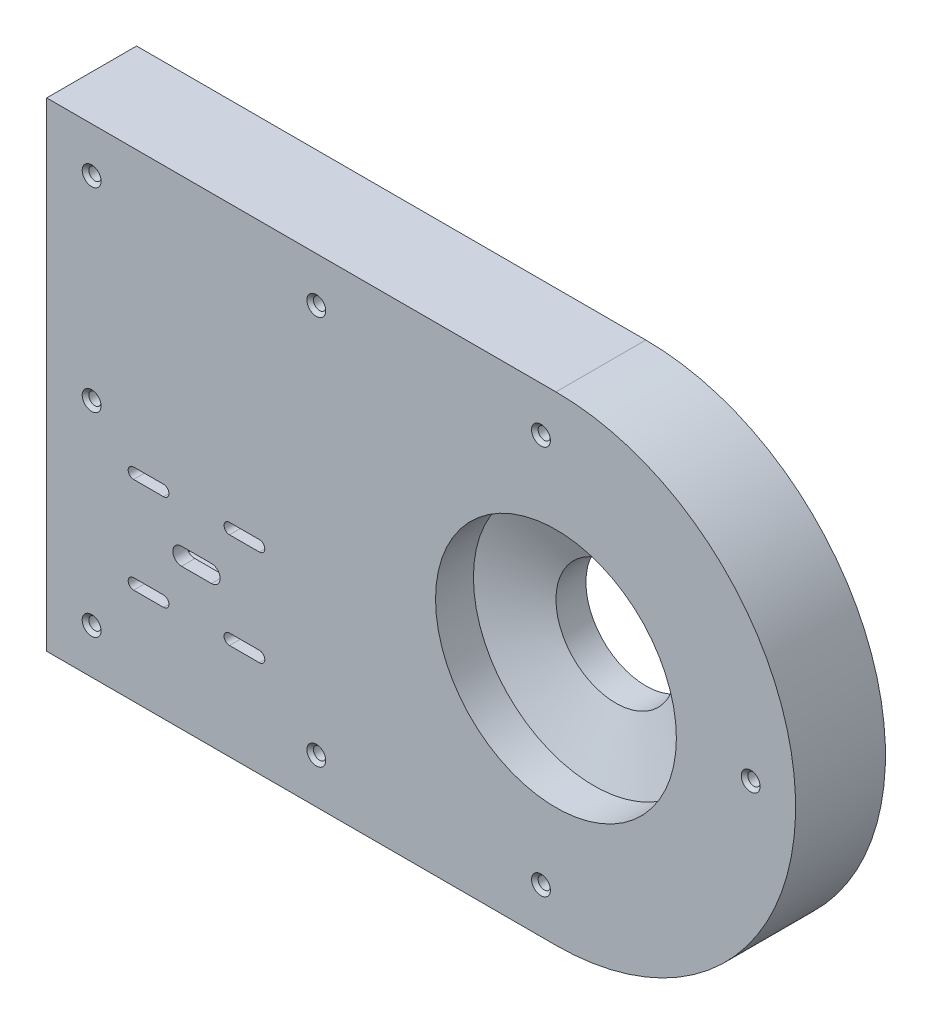
from build123d import *

# Parameters (mm, degrees)
SKETCH1_R                                       = 2.05
BOSS_EXTRUDE1_DEPTH                             = 15
CSK_FOR_M3_FLAT_HEAD_MACHINE_SCREW1_D           = 3.6
CSK_FOR_M3_FLAT_HEAD_MACHINE_SCREW1_CSINK_D     = 6.3
CSK_FOR_M3_FLAT_HEAD_MACHINE_SCREW1_CSINK_ANGLE = 90
CUT_EXTRUDE1_START                              = -10
SKETCH5_R                                       = 40.2
CUT_EXTRUDE1_DEPTH                              = 20
SKETCH6_R                                       = 20
CUT_EXTRUDE2_DEPTH                              = 191.26297592
CUT_EXTRUDE3_DEPTH                              = 22.27
M3_CLEARANCE_HOLE1_D                            = 3.6
M5_CLEARANCE_HOLE1_D                            = 5.8
CUT_EXTRUDE4_DEPTH                              = 3.27
CUT_EXTRUDE5_DEPTH                              = 190.1981842
SKETCH15_R                                      = 45.15
SKETCH15_R_2                                    = 32.35
CUT_EXTRUDE6_DEPTH                              = 2


with BuildPart() as part:
    # Sketch1 → Boss-Extrude1 (new, symmetric)
    with BuildSketch(Plane.XY):
        with BuildLine():
            Line((0, 80), (-170, 80))
            Line((-170, 80), (-170, -80))
            Line((-170, -80), (0, -80))
            ThreePointArc((0, -80), (80, 0), (0, 80))
        make_face()
        with Locations((-155, 65)):
            Circle(SKETCH1_R, mode=Mode.SUBTRACT)
        with Locations((-80, 65)):
            Circle(SKETCH1_R, mode=Mode.SUBTRACT)
        with Locations((-5, 65)):
            Circle(SKETCH1_R, mode=Mode.SUBTRACT)
        with Locations(Location((-155, -65, 0), (0, 0, 180))):
            Circle(SKETCH1_R, mode=Mode.SUBTRACT)
        with Locations(Location((-80, -65, 0), (0, 0, 180))):
            Circle(SKETCH1_R, mode=Mode.SUBTRACT)
        with Locations(Location((-5, -65, 0), (0, 0, 180))):
            Circle(SKETCH1_R, mode=Mode.SUBTRACT)
        with Locations(Location((-155, 0, 0), (0, 0, 180))):
            Circle(SKETCH1_R, mode=Mode.SUBTRACT)
        with Locations((65, 0)):
            Circle(SKETCH1_R, mode=Mode.SUBTRACT)
    extrude(amount=BOSS_EXTRUDE1_DEPTH, both=True)

    # CSK for M3 Flat Head Machine Screw1 (through all)
    with Locations(Plane.XY.offset(15)):
        with Locations((-5, -65), (-80, -65), (-155, -65), (-155, 0), (-155, 65), (-80, 65), (-5, 65), (65, 0)):
            CounterSinkHole(CSK_FOR_M3_FLAT_HEAD_MACHINE_SCREW1_D / 2, CSK_FOR_M3_FLAT_HEAD_MACHINE_SCREW1_CSINK_D / 2, counter_sink_angle=CSK_FOR_M3_FLAT_HEAD_MACHINE_SCREW1_CSINK_ANGLE)

    # Sketch5 → Cut-Extrude1 (cut)
    with BuildSketch(Plane(origin=(0, 0, -15), x_dir=(-1, 0, 0), z_dir=(0, 0, -1)).offset(CUT_EXTRUDE1_START)):
        Circle(SKETCH5_R)
    extrude(amount=-CUT_EXTRUDE1_DEPTH, mode=Mode.SUBTRACT)

    # Sketch6 → Cut-Extrude2 (cut, through all)
    with BuildSketch(Plane(origin=(0, 0, -15), x_dir=(-1, 0, 0), z_dir=(0, 0, -1))):
        Circle(SKETCH6_R)
    extrude(amount=-CUT_EXTRUDE2_DEPTH, mode=Mode.SUBTRACT)

    # Sketch7 → Cut-Extrude3 (cut)
    with BuildSketch(Plane(origin=(0, 0, -15), x_dir=(-1, 0, 0), z_dir=(0, 0, -1))):
        Polygon((103.85, -51.15), (146.15, -51.15), (146.15, -8.85), (103.85, -8.85), (93.85, -8.85), (93.85, -51.15), align=None)
    extrude(amount=-CUT_EXTRUDE3_DEPTH, mode=Mode.SUBTRACT)

    # M3 Clearance Hole1 (through all)
    with Locations(Plane(origin=(0, 0, 7.27), x_dir=(-1, 0, 0), z_dir=(0, 0, -1))):
        with Locations((109, -14), (141, -14), (141, -46), (109, -46), (99, -14), (99, -46), (131, -46), (131, -14)):
            Hole(M3_CLEARANCE_HOLE1_D / 2)

    # M5 Clearance Hole1 (through all)
    with Locations(Plane(origin=(0, 0, 7.27), x_dir=(-1, 0, 0), z_dir=(0, 0, -1))):
        with Locations((125, -30), (115, -30)):
            Hole(M5_CLEARANCE_HOLE1_D / 2)

    # Sketch13 → Cut-Extrude4 (cut)
    with BuildSketch(Plane(origin=(0, 0, 7.27), x_dir=(-1, 0, 0), z_dir=(0, 0, -1))):
        with BuildLine():
            Line((115, -18.85), (125, -18.85))
            ThreePointArc((125, -18.85), (136.15, -30), (125, -41.15))
            Line((125, -41.15), (115, -41.15))
            ThreePointArc((115, -41.15), (103.85, -30), (115, -18.85))
        make_face()
    extrude(amount=-CUT_EXTRUDE4_DEPTH, mode=Mode.SUBTRACT)

    # Sketch14 → Cut-Extrude5 (cut, through all)
    with BuildSketch(Plane(origin=(0, 0, 7.27), x_dir=(-1, 0, 0), z_dir=(0, 0, -1))):
        with BuildLine():
            Line((115, -27.1), (125, -27.1))
            ThreePointArc((125, -27.1), (127.9, -30), (125, -32.9))
            Line((125, -32.9), (115, -32.9))
            ThreePointArc((115, -32.9), (112.1, -30), (115, -27.1))
        make_face()
        with BuildLine():
            Line((99, -12.2), (109, -12.2))
            ThreePointArc((109, -12.2), (110.8, -14), (109, -15.8))
            Line((109, -15.8), (99, -15.8))
            ThreePointArc((99, -15.8), (97.2, -14), (99, -12.2))
        make_face()
        with BuildLine():
            Line((131, -12.2), (141, -12.2))
            ThreePointArc((141, -12.2), (142.8, -14), (141, -15.8))
            Line((141, -15.8), (131, -15.8))
            ThreePointArc((131, -15.8), (129.2, -14), (131, -12.2))
        make_face()
        with BuildLine():
            Line((141, -47.8), (131, -47.8))
            ThreePointArc((131, -47.8), (129.2, -46), (131, -44.2))
            Line((131, -44.2), (141, -44.2))
            ThreePointArc((141, -44.2), (142.8, -46), (141, -47.8))
        make_face()
        with BuildLine():
            Line((109, -47.8), (99, -47.8))
            ThreePointArc((99, -47.8), (97.2, -46), (99, -44.2))
            Line((99, -44.2), (109, -44.2))
            ThreePointArc((109, -44.2), (110.8, -46), (109, -47.8))
        make_face()
    extrude(amount=-CUT_EXTRUDE5_DEPTH, mode=Mode.SUBTRACT)

    # Sketch15 → Cut-Extrude6 (cut)
    with BuildSketch(Plane(origin=(0, 0, -15), x_dir=(-1, 0, 0), z_dir=(0, 0, -1))):
        Circle(SKETCH15_R)
        Circle(SKETCH15_R_2, mode=Mode.SUBTRACT)
    extrude(amount=-CUT_EXTRUDE6_DEPTH, mode=Mode.SUBTRACT)

    # Sketch16 → Revolve3 (revolve)
    with BuildSketch(Plane(origin=(0, 0, 0), x_dir=(1, 0, 0), z_dir=(0, 1, 0)), mode=Mode.PRIVATE) as revolve3_sk:
        Polygon((20, 5), (40.2, 5), (40.2, -2.352198732), align=None)
    revolve(revolve3_sk.sketch.rotate(Axis((0, 0, -9.069234204), (0, 0, 1)), 180), axis=Axis((0, 0, -9.069234204), (0, 0, 1)))


solid = part.part
